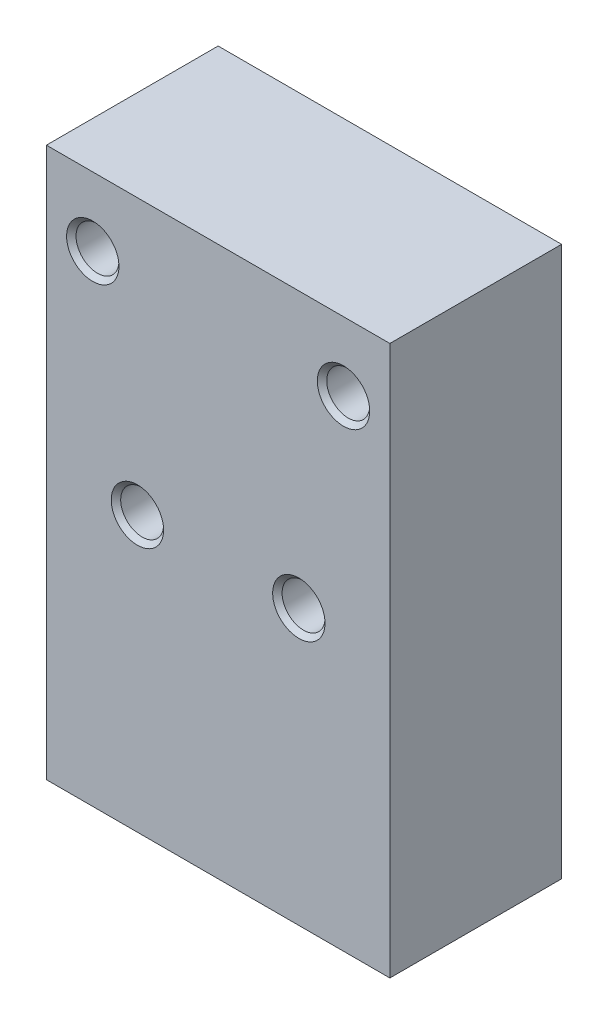
from build123d import *

# Parameters (mm, degrees)
EXTRUDE_1_DEPTH              = 20
HOLE_WIZARD_M3_1_D           = 2.5
HOLE_WIZARD_M3_1_DEPTH       = 10
HOLE_WIZARD_M3_1_CSINK_D     = 3.05
HOLE_WIZARD_M3_1_CSINK_ANGLE = 90
HOLE_WIZARD_M3_1_TIP         = 0.751075774
HOLE_WIZARD_M3_2_D           = 2.5
HOLE_WIZARD_M3_2_CSINK_D     = 3.05
HOLE_WIZARD_M3_2_CSINK_ANGLE = 90
HOLE_WIZARD_M3_4_D           = 2.5
HOLE_WIZARD_M3_4_CSINK_D     = 3.05
HOLE_WIZARD_M3_4_CSINK_ANGLE = 90
SKETCH_9_W                   = 20
SKETCH_9_H                   = 3.237584756
EXTRUDE_2_DEPTH              = 2
SKETCH_12_W                  = 20
SKETCH_12_H                  = 11.028073375
CUT_EXTRUDE_1_DEPTH          = 39.223029707
SKETCH_13_W                  = 20
SKETCH_13_H                  = 8
EXTRUDE_3_DEPTH              = 2


with BuildPart() as part:
    # 草图1 → 凸台-拉伸1 (new body)
    with BuildSketch(Plane(origin=(0, 0, 0), x_dir=(0, 0, -1), z_dir=(1, 0, 0))):
        Polygon((0, 28), (-2, 28), (-2, -2), (8, -2), (8, 0), (8, 28), align=None)
    extrude(amount=EXTRUDE_1_DEPTH)

    # M3 螺纹孔1
    with Locations(Plane(origin=(5, -2, -3), x_dir=(0, 0, -1), z_dir=(0, -1, 0))):
        with Locations((0, 0), (0, 10)):
            CounterSinkHole(HOLE_WIZARD_M3_1_D / 2, HOLE_WIZARD_M3_1_CSINK_D / 2, depth=HOLE_WIZARD_M3_1_DEPTH, counter_sink_angle=HOLE_WIZARD_M3_1_CSINK_ANGLE)
            with Locations((0, 0, -(HOLE_WIZARD_M3_1_DEPTH + HOLE_WIZARD_M3_1_TIP / 2))):  # 118° drill point
                Cone(0, HOLE_WIZARD_M3_1_D / 2, HOLE_WIZARD_M3_1_TIP, mode=Mode.SUBTRACT)

    # M3 螺纹孔2 (through all)
    with Locations(Plane(origin=(14.7, 14, 2), x_dir=(0, 1, 0), z_dir=(0, 0, 1))):
        with Locations((0, 0), (12, 12)):
            CounterSinkHole(HOLE_WIZARD_M3_2_D / 2, HOLE_WIZARD_M3_2_CSINK_D / 2, counter_sink_angle=HOLE_WIZARD_M3_2_CSINK_ANGLE)

    # M3 螺纹孔4 (through all)
    with Locations(Plane(origin=(5.3, 14, 2), x_dir=(0, 1, 0), z_dir=(0, 0, 1))):
        with Locations((0, 0), (12, -12)):
            CounterSinkHole(HOLE_WIZARD_M3_4_D / 2, HOLE_WIZARD_M3_4_CSINK_D / 2, counter_sink_angle=HOLE_WIZARD_M3_4_CSINK_ANGLE)

    # 草图9 → 凸台-拉伸2 (add)
    with BuildSketch(Plane.XY.offset(2)):
        with Locations((10, 29.381207622)):
            Rectangle(SKETCH_9_W, SKETCH_9_H)
    extrude(amount=-EXTRUDE_2_DEPTH)

    # 草图12 → 切除-拉伸1 (cut, through all)
    with BuildSketch(Plane.XY.offset(2)):
        with Locations((10, 35.514036688)):
            Rectangle(SKETCH_12_W, SKETCH_12_H)
    extrude(amount=-CUT_EXTRUDE_1_DEPTH, mode=Mode.SUBTRACT)

    # 草图13 → 凸台-拉伸3 (add)
    with BuildSketch(Plane(origin=(0, 28, 0), x_dir=(1, 0, 0), z_dir=(0, 1, 0))):
        with Locations((10, 4)):
            Rectangle(SKETCH_13_W, SKETCH_13_H)
    extrude(amount=EXTRUDE_3_DEPTH)


solid = part.part
